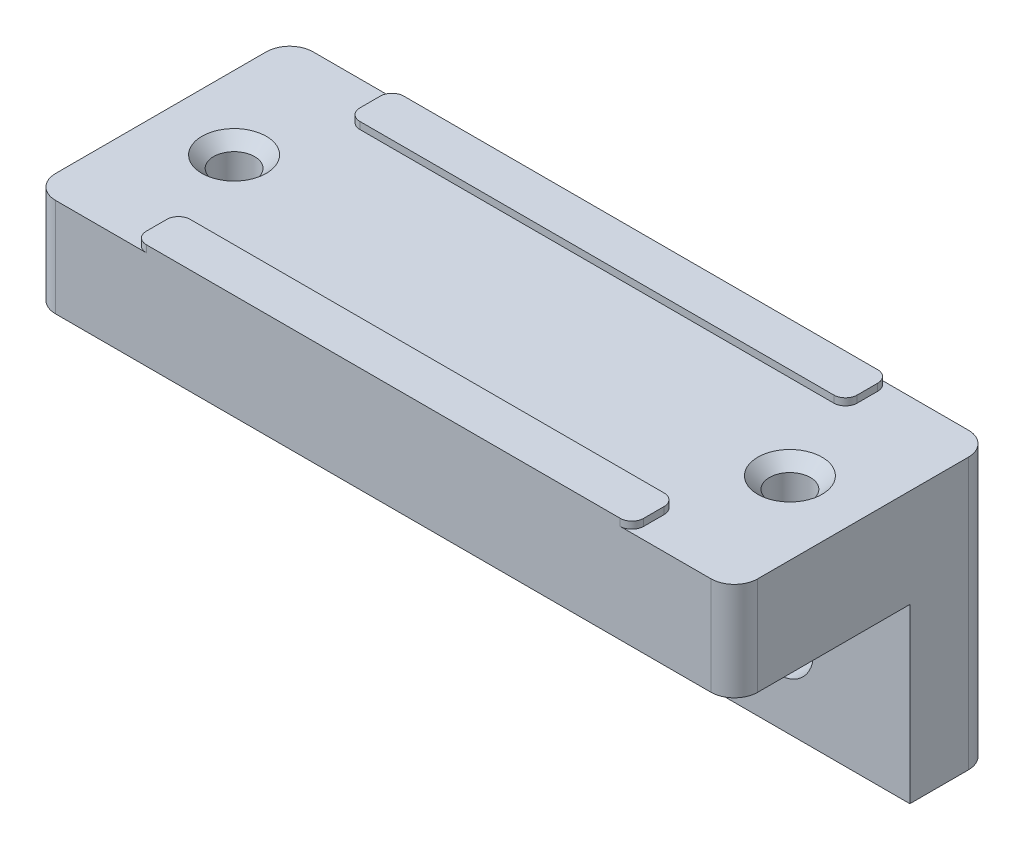
from build123d import *

# Parameters (mm, degrees)
BOSS_EXTRUDE1_DEPTH            = 15.24
SKETCH7_OUTSIDE_W              = 39.406
SKETCH7_OUTSIDE_H              = 20.102
CUT_EXTRUDE2_DEPTH             = 0.3048
F_2_56_TAPPED_HOLE1_AT_2_COUNT = 2
F_2_56_TAPPED_HOLE1_AT_2_PITCH = 24.13
F_31_0_12_DIAMETER_HOLE1_D     = 3.048
FILLET1_R                      = 1.016


with BuildPart() as part:
    # Sketch1 → Boss-Extrude1 (new, symmetric)
    with BuildSketch(Plane(origin=(0, 0, 0), x_dir=(0, 0, -1), z_dir=(1, 0, 0))):
        Polygon((5.588, 0), (-5.588, 0), (-5.588, -4.572), (2.032, -4.572), (2.032, -12.065), (5.588, -12.065), align=None)
    extrude(amount=BOSS_EXTRUDE1_DEPTH, both=True)

    # Sketch7 outside → Cut-Extrude2 (cut)
    with BuildSketch(Plane(origin=(0, 0, 0), x_dir=(1, 0, 0), z_dir=(0, 1, 0))):
        Rectangle(SKETCH7_OUTSIDE_W, SKETCH7_OUTSIDE_H)
        with BuildLine():
            Line((10.795, -4.191), (10.795, -5.08))
            ThreePointArc((10.795, -5.08), (10.646210245, -5.439210245), (10.287, -5.588))
            Line((10.287, -5.588), (-10.287, -5.588))
            ThreePointArc((-10.287, -5.588), (-10.646210245, -5.439210245), (-10.795, -5.08))
            Line((-10.795, -5.08), (-10.795, -4.191))
            ThreePointArc((-10.795, -4.191), (-10.646210245, -3.831789755), (-10.287, -3.683))
            Line((-10.287, -3.683), (10.287, -3.683))
            ThreePointArc((10.287, -3.683), (10.646210245, -3.831789755), (10.795, -4.191))
        make_face(mode=Mode.SUBTRACT)
        with BuildLine():
            Line((-10.287, 3.683), (10.287, 3.683))
            ThreePointArc((10.287, 3.683), (10.646210245, 3.831789755), (10.795, 4.191))
            Line((10.795, 4.191), (10.795, 5.08))
            ThreePointArc((10.795, 5.08), (10.646210245, 5.439210245), (10.287, 5.588))
            Line((10.287, 5.588), (-10.287, 5.588))
            ThreePointArc((-10.287, 5.588), (-10.646210245, 5.439210245), (-10.795, 5.08))
            Line((-10.795, 5.08), (-10.795, 4.191))
            ThreePointArc((-10.795, 4.191), (-10.646210245, 3.831789755), (-10.287, 3.683))
        make_face(mode=Mode.SUBTRACT)
    extrude(amount=-CUT_EXTRUDE2_DEPTH, mode=Mode.SUBTRACT)

    # Sketch2 → #2-56 Tapped Hole1 (revolve, cut)
    with BuildSketch(Plane(origin=(-12.065, -0.3048, 0), x_dir=(0, 0, 1), z_dir=(1, 0, 0))):
        Polygon((0, 0), (0, 4.2672), (1.397, 4.2672), (0.889, 3.7592), (0.889, 0.508), (1.397, 0), align=None)
    f_2_56_tapped_hole1 = revolve(axis=Axis((-12.065, 6.0452, 0), (0, -1, 0)), mode=Mode.SUBTRACT)

    # #2-56 Tapped Hole1 at 2: #2-56 Tapped Hole1 ×2
    with Locations(*[(i * F_2_56_TAPPED_HOLE1_AT_2_PITCH, 0, 0) for i in range(1, F_2_56_TAPPED_HOLE1_AT_2_COUNT)]):
        add(f_2_56_tapped_hole1, mode=Mode.SUBTRACT)

    # #31 (0.12) Diameter Hole1 (through all)
    with Locations(Plane(origin=(-4.633152105, -2.095479982, -2.032), x_dir=(1, 0, 0), z_dir=(0, 0, 1))):
        with Locations((-4.891847895, -6.438920018), (14.158152105, -6.438920018)):
            Hole(F_31_0_12_DIAMETER_HOLE1_D / 2)

    # Fillet1
    fillet1_edges = [part.edges().sort_by_distance(p)[0] for p in [
        (-15.24, -2.4384, 5.588),
        (15.24, -2.4384, 5.588),
        (15.24, -6.1849, -5.588),
        (-15.24, -6.1849, -5.588),
    ]]
    fillet(fillet1_edges, radius=FILLET1_R)


solid = part.part
